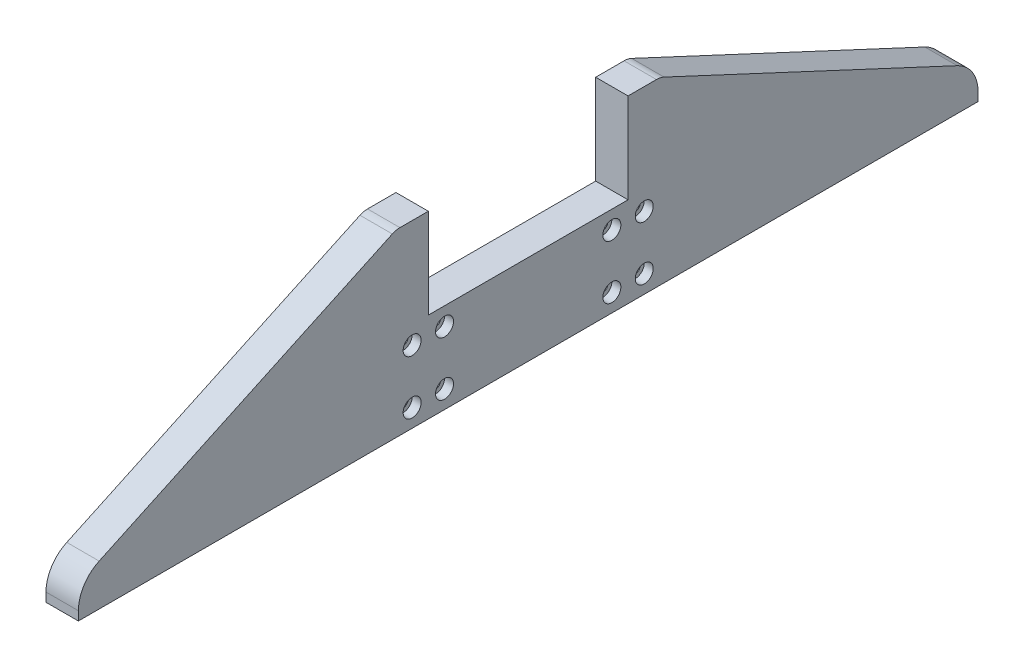
from build123d import *

# Parameters (mm, degrees)
SKETCH1_W                               = 18
SKETCH1_H                               = 100
BASE_DEPTH                              = 500
SKETCH2_W                               = 111
SKETCH2_H                               = 50
LAP_JOINT_CUTOUT_DEPTH                  = 511.219560582
LAP_JOINT_BOLT_HOLE_PATTERN_D           = 5.5
LAP_JOINT_BOLT_HOLE_PATTERN_CBORE_D     = 10
LAP_JOINT_BOLT_HOLE_PATTERN_CBORE_DEPTH = 5
CHAMFER_FRONT_SIZE                      = 176.5
CHAMFER_FRONT_SIZE2                     = 82.303301664
CHAMFER_REAR_SIZE                       = 176.5
CHAMFER_REAR_SIZE2                      = 82.303301664
BREAK_CHAMFER_OUTER_CORNERS_R           = 20
CROSS_TIE_BOLT_HOLE_PATTERN_D           = 5.5
CROSS_TIE_BOLT_HOLE_PATTERN_CBORE_D     = 10
CROSS_TIE_BOLT_HOLE_PATTERN_CBORE_DEPTH = 5
FILLET1_R                               = 10


with BuildPart() as part:
    # Sketch1 → base (new body)
    with BuildSketch(Plane.XY):
        with Locations((9, 50)):
            Rectangle(SKETCH1_W, SKETCH1_H)
    extrude(amount=BASE_DEPTH)

    # Sketch2 → lap joint cutout (cut, through all)
    with BuildSketch(Plane.ZY):
        with Locations((250, 75)):
            Rectangle(SKETCH2_W, SKETCH2_H)
    extrude(amount=-LAP_JOINT_CUTOUT_DEPTH, mode=Mode.SUBTRACT)

    # lap joint bolt hole pattern (through all)
    with Locations(Plane(origin=(18, 0, 0), x_dir=(0, 0, -1), z_dir=(1, 0, 0))):
        with Locations((-296.5, 40), (-203.5, 10), (-296.5, 10), (-203.5, 40)):
            CounterBoreHole(LAP_JOINT_BOLT_HOLE_PATTERN_D / 2, LAP_JOINT_BOLT_HOLE_PATTERN_CBORE_D / 2, LAP_JOINT_BOLT_HOLE_PATTERN_CBORE_DEPTH)

    # chamfer front
    chamfer_front_edges = [part.edges().sort_by_distance(p)[0] for p in [
        (9, 100, 0),
    ]]
    chamfer_front_side = [part.faces().sort_by_distance(p)[0] for p in [
        (9, 100, 97.25),
    ]]
    chamfer(chamfer_front_edges, length=CHAMFER_FRONT_SIZE, length2=CHAMFER_FRONT_SIZE2, reference=chamfer_front_side[0])

    # chamfer rear
    chamfer_rear_edges = [part.edges().sort_by_distance(p)[0] for p in [
        (9, 100, 500),
    ]]
    chamfer_rear_side = [part.faces().sort_by_distance(p)[0] for p in [
        (9, 100, 402.75),
    ]]
    chamfer(chamfer_rear_edges, length=CHAMFER_REAR_SIZE, length2=CHAMFER_REAR_SIZE2, reference=chamfer_rear_side[0])

    # break chamfer outer corners
    break_chamfer_outer_corners_edges = [part.edges().sort_by_distance(p)[0] for p in [
        (9, 17.696698336, 0),
        (9, 17.696698336, 500),
    ]]
    fillet(break_chamfer_outer_corners_edges, radius=BREAK_CHAMFER_OUTER_CORNERS_R)

    # cross tie bolt hole pattern (through all)
    with Locations(Plane(origin=(18, 0, 0), x_dir=(0, 0, -1), z_dir=(1, 0, 0))):
        with Locations((-314.5, 40), (-314.5, 10)):
            cross_tie_bolt_hole_pattern = CounterBoreHole(CROSS_TIE_BOLT_HOLE_PATTERN_D / 2, CROSS_TIE_BOLT_HOLE_PATTERN_CBORE_D / 2, CROSS_TIE_BOLT_HOLE_PATTERN_CBORE_DEPTH)

    # mirror cross tie bolt hole pattern: cross tie bolt hole pattern across plane
    add(cross_tie_bolt_hole_pattern.mirror(Plane(origin=(0, 0, 250), x_dir=(1, 0, 0), z_dir=(0, 0, -1))), mode=Mode.SUBTRACT)

    # Fillet1
    fillet1_edges = [part.edges().sort_by_distance(p)[0] for p in [
        (9, 100, 176.5),
        (9, 100, 323.5),
    ]]
    fillet(fillet1_edges, radius=FILLET1_R)


solid = part.part
